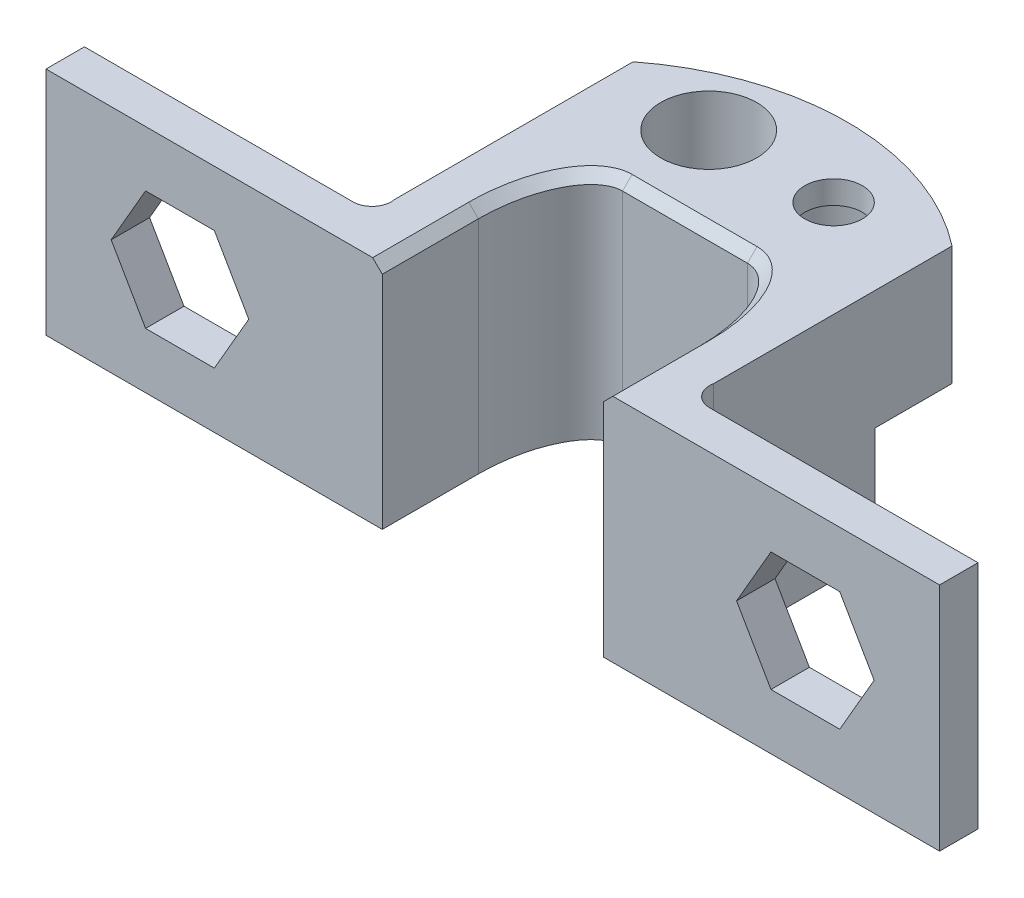
from build123d import *

# Parameters (mm, degrees)
BOSS_EXTRUDE1_DEPTH = 12
CUT_EXTRUDE1_DEPTH  = 10
SKETCH3_R           = 2.5
SKETCH3_R_2         = 1.5
BOSS_EXTRUDE2_DEPTH = 1.2
SKETCH4_R           = 2.5
BOSS_EXTRUDE3_DEPTH = 5
CHAMFER1_SIZE       = 0.5


with BuildPart() as part:
    # Sketch1 → Boss-Extrude1 (new body)
    with BuildSketch(Plane(origin=(0, 0, 0), x_dir=(1, 0, 0), z_dir=(0, 1, 0))):
        with BuildLine():
            Line((-23.25, -5), (-5.749755012, -5))
            Line((-5.749755012, -5), (-5.749755012, 0))
            add(Edge.make_bspline(
                [(-3.25, 5), (-5.749755012, 5), (-5.749755012, 0)],
                knots=[0, 0, 0, 1.570796327, 1.570796327, 1.570796327], degree=2, weights=[1, 0.707106781, 1]))
            Line((-3.25, 5), (3.25, 5))
            add(Edge.make_bspline(
                [(5.748694825, 0), (5.748694825, 5), (3.25, 5)],
                knots=[4.71238898, 4.71238898, 4.71238898, 6.283185307, 6.283185307, 6.283185307], degree=2, weights=[1, 0.707106781, 1]))
            Line((5.748694825, 0), (5.748694825, -5))
            Line((5.748694825, -5), (23.25, -5))
            Line((23.25, -5), (23.25, -3))
            Line((23.25, -3), (9.282157642, -3))
            ThreePointArc((9.282157642, -3), (8.511424396, -2.637157958), (8.3, -1.811940526))
            Line((8.3, -1.811940526), (8.3, 6.6))
            Line((8.3, 6.6), (-8.3, 6.6))
            Line((-8.3, 6.6), (-8.3, -1.812055437))
            ThreePointArc((-8.3, -1.812055437), (-8.511483666, -2.637203044), (-9.282179638, -3))
            Line((-9.282179638, -3), (-23.25, -3))
            Line((-23.25, -3), (-23.25, -5))
        make_face()
    extrude(amount=BOSS_EXTRUDE1_DEPTH)

    # Sketch2 → Cut-Extrude1 (cut)
    with BuildSketch(Plane(origin=(0, 0, 3), x_dir=(-1, 0, 0), z_dir=(0, 0, -1))):
        Polygon((19.85850269, 6), (18.068716856, 9.1), (14.489145187, 9.1), (12.699359352, 6), (14.489145187, 2.9), (18.068716856, 2.9), align=None)
        Polygon((-12.686507152, 6), (-14.476292987, 9.1), (-18.055864656, 9.1), (-19.84565049, 6), (-18.055864656, 2.9), (-14.476292987, 2.9), align=None)
    extrude(amount=-CUT_EXTRUDE1_DEPTH, mode=Mode.SUBTRACT)

    # Sketch3 → Boss-Extrude2 (add)
    with BuildSketch(Plane(origin=(0, 12, 0), x_dir=(1, 0, 0), z_dir=(0, 1, 0))):
        with BuildLine():
            Line((-8.3, 6.6), (8.3, 6.6))
            Line((8.3, 6.6), (8.3, 10.6))
            ThreePointArc((8.3, 10.6), (0, 13.462912018), (-8.3, 10.6))
            Line((-8.3, 10.6), (-8.3, 6.6))
        make_face()
        with Locations(Location((-3.25, 9.48526903, 0), (0, 0, 270))):
            Circle(SKETCH3_R, mode=Mode.SUBTRACT)
        with Locations(Location((3.25, 9.48526903, 0), (0, 0, 270))):
            Circle(SKETCH3_R_2, mode=Mode.SUBTRACT)
    extrude(amount=-BOSS_EXTRUDE2_DEPTH)

    # Sketch4 → Boss-Extrude3 (add)
    with BuildSketch(Plane.XZ.offset(-10.8)):
        with BuildLine():
            Line((8.3, -6.6), (-8.3, -6.6))
            Line((-8.3, -6.6), (-8.3, -10.6))
            ThreePointArc((-8.3, -10.6), (0, -13.462912018), (8.3, -10.6))
            Line((8.3, -10.6), (8.3, -6.6))
        make_face()
        with Locations(Location((-3.25, -9.48526903, 0), (0, 0, 90))):
            Circle(SKETCH4_R, mode=Mode.SUBTRACT)
        with Locations(Location((3.25, -9.48526903, 0), (0, 0, 270))):
            Circle(SKETCH4_R, mode=Mode.SUBTRACT)
    extrude(amount=BOSS_EXTRUDE3_DEPTH)

    # Chamfer1
    chamfer1_edges = [part.edges().sort_by_distance(p)[0] for p in [
        (0, 12, -5),
        (-5.260112096, 12, -2.972310439),
        (5.259369228, 12, -2.972013605),
        (-5.749755012, 12, 2.5),
        (5.748694825, 12, 2.5),
    ]]
    chamfer(chamfer1_edges, length=CHAMFER1_SIZE)


solid = part.part
